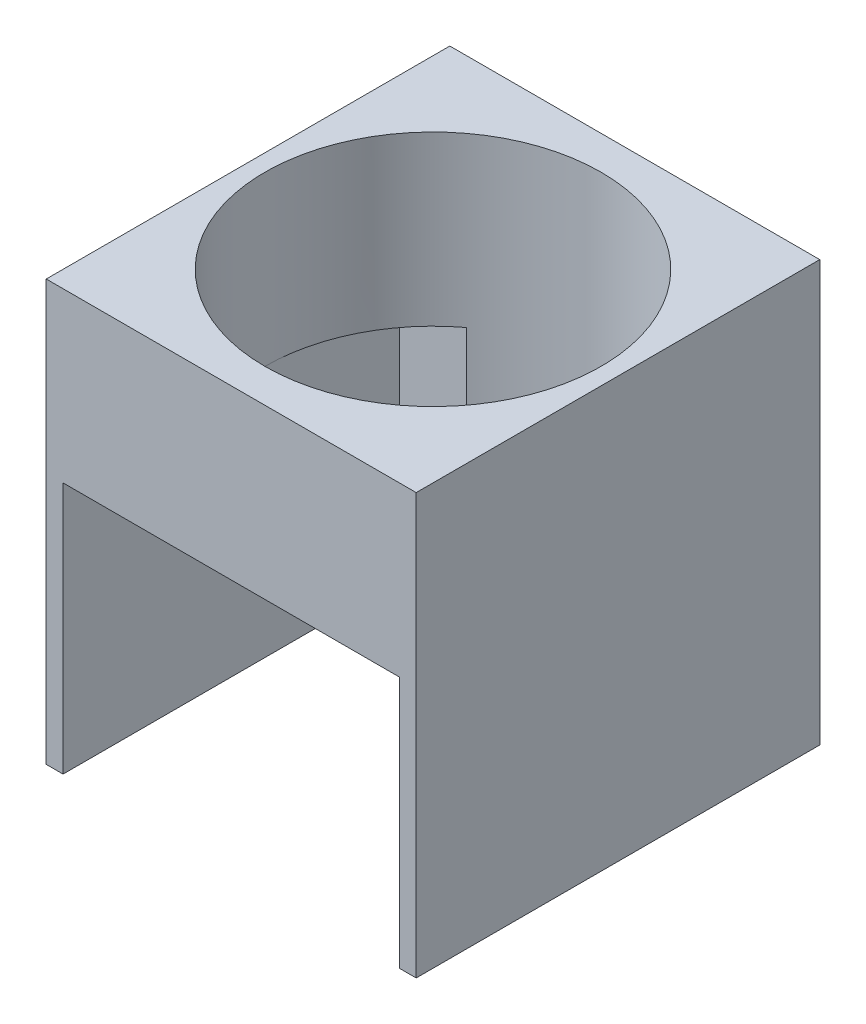
from build123d import *

# Parameters (mm, degrees)
SKETCH1_W                      = 670
SKETCH1_H                      = 120
BOSS_EXTRUDE1_DEPTH            = 530
SKETCH2_W                      = 100
SKETCH2_H                      = 200
SKETCH2_W_2                    = 650
SKETCH2_H_2                    = 250
CUT_EXTRUDE1_DEPTH             = 100
SKETCH3_R                      = 50
CUT_EXTRUDE2_DEPTH             = 260
F_12_0_12_DIAMETER_HOLE2_D     = 12
F_12_0_12_DIAMETER_HOLE2_DEPTH = 30
F_12_0_12_DIAMETER_HOLE2_TIP   = 3.605163714
SKETCH8_W                      = 650
SKETCH8_H                      = 50
BOSS_EXTRUDE2_DEPTH            = 5
SKETCH9_W                      = 10
SKETCH9_H                      = 250
CUT_EXTRUDE3_DEPTH             = 717
CUT_EXTRUDE4_DEPTH             = 5
SKETCH11_W                     = 10
SKETCH11_H                     = 100
BOSS_EXTRUDE3_DEPTH            = 78
BOSS_EXTRUDE3_2_DEPTH          = 78
BOSS_EXTRUDE3_3_DEPTH          = 78
SKETCH12_W                     = 20
SKETCH12_H                     = 30
CUT_EXTRUDE5_DEPTH             = 80
SKETCH15_W                     = 30
SKETCH15_H                     = 23.536156656
SKETCH15_H_2                   = 28.986603691
CUT_EXTRUDE7_DEPTH             = 35
SHELL1_T                       = -3
SKETCH16_W                     = 14
SKETCH16_H                     = 14
CUT_EXTRUDE8_DEPTH             = 35
SKETCH17_W                     = 5.729882812
SKETCH17_H                     = 17.428393554
SKETCH17_W_2                   = 13.369726562
SKETCH17_H_2                   = 3.342431641
BOSS_EXTRUDE4_DEPTH            = 5
SKETCH18_W                     = 670
SKETCH18_H                     = 280
CUT_EXTRUDE10_DEPTH            = 159
CUT_EXTRUDE11_DEPTH            = 863.670273187
CUT_EXTRUDE11_DEPTH_BACK       = 863.670273187
SKETCH19_W                     = 115
SKETCH19_H                     = 250
SKETCH19_W_2                   = 445
CUT_EXTRUDE12_DEPTH            = 777.739982373
CUT_EXTRUDE12_DEPTH_BACK       = 777.739982373
SKETCH20_W                     = 110
SKETCH20_H                     = 125


with BuildPart() as part:
    # Sketch1 → Boss-Extrude1 (new body)
    with BuildSketch(Plane(origin=(0, 0, 0), x_dir=(1, 0, 0), z_dir=(0, 1, 0))):
        with Locations((335, 60)):
            Rectangle(SKETCH1_W, SKETCH1_H)
    extrude(amount=BOSS_EXTRUDE1_DEPTH)

    # Sketch2 → Cut-Extrude1 (cut)
    with BuildSketch(Plane.XY):
        with Locations((60, 380)):
            Rectangle(SKETCH2_W, SKETCH2_H)
        with Locations((170, 380)):
            Rectangle(SKETCH2_W, SKETCH2_H)
        with Locations((280, 380)):
            Rectangle(SKETCH2_W, SKETCH2_H)
        with Locations((390, 380)):
            Rectangle(SKETCH2_W, SKETCH2_H)
        with Locations((500, 380)):
            Rectangle(SKETCH2_W, SKETCH2_H)
        with Locations((610, 380)):
            Rectangle(SKETCH2_W, SKETCH2_H)
        with Locations((335, 135)):
            Rectangle(SKETCH2_W_2, SKETCH2_H_2)
    extrude(amount=-CUT_EXTRUDE1_DEPTH, mode=Mode.SUBTRACT)

    # Sketch3 → Cut-Extrude2 (cut)
    with BuildSketch(Plane(origin=(0, 530, 0), x_dir=(1, 0, 0), z_dir=(0, 1, 0))):
        with Locations(Location((60, 60, 0), (0, 0, 270))):
            Circle(SKETCH3_R)
        with Locations(Location((170, 60, 0), (0, 0, 270))):
            Circle(SKETCH3_R)
        with Locations(Location((280, 60, 0), (0, 0, 270))):
            Circle(SKETCH3_R)
        with Locations(Location((390, 60, 0), (0, 0, 270))):
            Circle(SKETCH3_R)
        with Locations(Location((500, 60, 0), (0, 0, 270))):
            Circle(SKETCH3_R)
        with Locations(Location((610, 60, 0), (0, 0, 270))):
            Circle(SKETCH3_R)
    extrude(amount=-CUT_EXTRUDE2_DEPTH, mode=Mode.SUBTRACT)

    # Ø12.0 (12) Diameter Hole2
    with Locations(Plane(origin=(59.704642413, 270, -102.411697903), x_dir=(0, 0, 1), z_dir=(0, 1, 0))):
        with Locations((0, 0), (-0.195888006, 111.8520513), (0.014838595, 221.167624818), (-0.341843303, 331.364008353), (0.657723149, 441.008646429), (1.288998006, 549.811854685)):
            Hole(F_12_0_12_DIAMETER_HOLE2_D / 2, depth=F_12_0_12_DIAMETER_HOLE2_DEPTH)
            with Locations((0, 0, -(F_12_0_12_DIAMETER_HOLE2_DEPTH + F_12_0_12_DIAMETER_HOLE2_TIP / 2))):  # 118° drill point
                Cone(0, F_12_0_12_DIAMETER_HOLE2_D / 2, F_12_0_12_DIAMETER_HOLE2_TIP, mode=Mode.SUBTRACT)

    # Sketch8 → Boss-Extrude2 (add)
    with BuildSketch(Plane.XY):
        with Locations((335, 305)):
            Rectangle(SKETCH8_W, SKETCH8_H)
    extrude(amount=-BOSS_EXTRUDE2_DEPTH)

    # Sketch9 → Cut-Extrude3 (cut)
    with BuildSketch(Plane(origin=(670, 0, 0), x_dir=(0, 0, -1), z_dir=(1, 0, 0))):
        with Locations((15, 135)):
            Rectangle(SKETCH9_W, SKETCH9_H)
    extrude(amount=-CUT_EXTRUDE3_DEPTH, mode=Mode.SUBTRACT)

    # Sketch10 → Cut-Extrude4 (cut)
    with BuildSketch(Plane(origin=(0, 10, 0), x_dir=(1, 0, 0), z_dir=(0, 1, 0))):
        Polygon((365, 61.943560596), (350, 87.924322709), (320, 87.924322709), (305, 61.943560596), (320, 35.962798482), (350, 35.962798482), align=None)
    extrude(amount=-CUT_EXTRUDE4_DEPTH, mode=Mode.SUBTRACT)

    # Sketch12 → Cut-Extrude5 (cut)
    with BuildSketch(Plane.XY.offset(-100)):
        with Locations((85.198613037, 245)):
            Rectangle(SKETCH12_W, SKETCH12_H)
        with Locations((195.198613037, 245)):
            Rectangle(SKETCH12_W, SKETCH12_H)
        with Locations((305.198613037, 245)):
            Rectangle(SKETCH12_W, SKETCH12_H)
        with Locations((415.198613037, 245)):
            Rectangle(SKETCH12_W, SKETCH12_H)
        with Locations((525.198613037, 245)):
            Rectangle(SKETCH12_W, SKETCH12_H)
        with Locations((635.198613037, 245)):
            Rectangle(SKETCH12_W, SKETCH12_H)
    extrude(amount=-CUT_EXTRUDE5_DEPTH, mode=Mode.SUBTRACT)

    # Sketch17 → Boss-Extrude4 (add)
    # profile 1 of 9: a face of its own
    with BuildSketch(Plane.XY):
        with BuildLine():
            Line((527.508830928, 289.835452458), (527.508830928, 307.263846012))
            Line((527.508830928, 307.263846012), (534.861434459, 307.263846012))
            add(Edge.make_bspline(
                [(534.861434459, 307.263846012), (535.181337774, 307.258256848), (535.803061116, 307.24739446), (536.703508491, 307.139069344), (537.544992916, 306.975202489), (538.325061607, 306.737496792), (539.040841948, 306.426020155), (539.698044515, 306.051894954), (540.290333057, 305.605079277), (540.822348212, 305.090232636), (541.284521701, 304.502523111), (541.692171296, 303.852565801), (542.030284458, 303.129762281), (542.309377095, 302.341316546), (542.5243908, 301.484161689), (542.679660381, 300.560045938), (542.773357357, 299.567500804), (542.783368073, 298.883107022), (542.788518428, 298.530997273)],
                knots=[0, 0, 0, 0, 1.135059408, 2.20595691, 3.214417064, 4.174978569, 5.094187092, 5.980001006, 6.853065862, 7.720814779, 8.600404634, 9.50058483, 10.438414914, 11.426825708, 12.465239141, 13.571113463, 14.750376389, 16, 16, 16, 16], degree=3))
            add(Edge.make_bspline(
                [(542.788518428, 298.530997273), (542.781740751, 298.180151665), (542.768592871, 297.499553336), (542.676885992, 296.511518461), (542.516733301, 295.591080531), (542.296748778, 294.736450427), (542.003051046, 293.953120444), (541.654236167, 293.233205539), (541.233025793, 292.585291498), (540.753136904, 292.000029304), (540.204772188, 291.484681411), (539.587651059, 291.044279297), (538.910779309, 290.668464036), (538.169670382, 290.361903209), (537.364073889, 290.124869172), (536.495133477, 289.954199984), (535.562644449, 289.853487388), (534.920131033, 289.841584621), (534.58911581, 289.835452458)],
                knots=[0, 0, 0, 0, 1.228418252, 2.382983832, 3.470276728, 4.496757894, 5.468023682, 6.394867725, 7.292157164, 8.167372942, 9.039072913, 9.918728341, 10.815246345, 11.744296628, 12.720973084, 13.750736166, 14.841206188, 16, 16, 16, 16], degree=3))
            Line((534.58911581, 289.835452458), (527.508830928, 289.835452458))
        make_face()
        with BuildLine():
            Line((533.238713741, 291.745413395), (534.048208904, 291.745413395))
            add(Edge.make_bspline(
                [(534.048208904, 291.745413395), (534.172894012, 291.749291978), (534.413033311, 291.756761998), (534.758676231, 291.825976613), (535.075745017, 291.938271137), (535.365749176, 292.094802589), (535.623404602, 292.300450923), (535.848862806, 292.551404902), (536.04776914, 292.844737637), (536.217685755, 293.190205032), (536.364284647, 293.596533622), (536.481764702, 294.076367921), (536.592118304, 294.630928744), (536.673672739, 295.265507643), (536.740044562, 295.978448886), (536.788346679, 296.768428292), (536.812018936, 297.636801208), (536.817188964, 298.241258393), (536.819890499, 298.55711002)],
                knots=[0, 0, 0, 0, 0.728710832, 1.403472396, 2.052289494, 2.690292559, 3.321919393, 3.970736491, 4.656696891, 5.388631723, 6.217040872, 7.17856157, 8.275589967, 9.523440737, 10.918935818, 12.463926104, 14.152268318, 16, 16, 16, 16], degree=3))
            add(Edge.make_bspline(
                [(536.819890499, 298.55711002), (536.8171426, 298.871715251), (536.811863063, 299.476166083), (536.7886758, 300.343334385), (536.739579947, 301.133216935), (536.674703848, 301.843934916), (536.589660404, 302.476324031), (536.488366458, 303.031681737), (536.362441588, 303.507627045), (536.222158727, 303.914921549), (536.050140993, 304.256514038), (535.858357073, 304.554097881), (535.62547107, 304.79746827), (535.36991257, 305.004888479), (535.079348843, 305.160875844), (534.761320266, 305.273944358), (534.414185903, 305.34216807), (534.172870641, 305.349893944), (534.048208904, 305.353885075)],
                knots=[0, 0, 0, 0, 1.842836665, 3.540640921, 5.080358154, 6.47765669, 7.719902824, 8.816971715, 9.781579111, 10.601733135, 11.334613876, 12.017393917, 12.666641099, 13.29908421, 13.937911793, 14.587567384, 15.270347425, 16, 16, 16, 16], degree=3))
            Line((534.048208904, 305.353885075), (533.238713741, 305.353885075))
            Line((533.238713741, 305.353885075), (533.238713741, 291.745413395))
        make_face(mode=Mode.SUBTRACT)
    # profile 2 of 9: a face of its own
    with BuildSketch(Plane.XY):
        with Locations((547.563420772, 298.549649235)):
            Rectangle(SKETCH17_W, SKETCH17_H)
    # profile 3 of 9: a face of its own
    with BuildSketch(Plane.XY):
        Polygon((564.514324092, 307.263846012), (564.514324092, 305.115139958), (558.545696163, 305.115139958), (558.545696163, 299.862747379), (563.559343624, 299.862747379), (563.559343624, 297.714041325), (558.545696163, 297.714041325), (558.545696163, 289.835452458), (552.81581335, 289.835452458), (552.81581335, 307.263846012), align=None)
    # profile 4 of 9: a face of its own
    with BuildSketch(Plane.XY):
        Polygon((577.645305538, 307.263846012), (577.645305538, 305.115139958), (571.676677608, 305.115139958), (571.676677608, 299.862747379), (576.690325069, 299.862747379), (576.690325069, 297.714041325), (571.676677608, 297.714041325), (571.676677608, 289.835452458), (565.946794795, 289.835452458), (565.946794795, 307.263846012), align=None)
    # profile 5 of 9: a face of its own
    with BuildSketch(Plane.XY):
        with Locations((584.330168819, 287.448001286)):
            Rectangle(SKETCH17_W_2, SKETCH17_H_2)
    # profile 6 of 9: a face of its own
    with BuildSketch(Plane.XY):
        with BuildLine():
            Line((605.578484249, 307.263846012), (605.578484249, 295.602639195))
            add(Edge.make_bspline(
                [(605.578484249, 295.602639195), (605.574209777, 295.35989389), (605.565919345, 294.889083964), (605.480877158, 294.20653885), (605.349958188, 293.569747554), (605.15926554, 292.978838165), (604.911867049, 292.436847071), (604.616163877, 291.936663973), (604.260702644, 291.487723021), (603.847299908, 291.08966617), (603.386881991, 290.731670113), (602.867295001, 290.425440037), (602.293741958, 290.168488385), (601.66690529, 289.960990771), (600.988052682, 289.797299786), (600.254912883, 289.679078851), (599.467035781, 289.60781007), (598.923618241, 289.60048219), (598.643684673, 289.59670734)],
                knots=[0, 0, 0, 0, 1.108173197, 2.149326602, 3.136215123, 4.073726706, 4.978516626, 5.852185058, 6.72141202, 7.584905625, 8.467554395, 9.379216169, 10.332422268, 11.332766067, 12.390653242, 13.518530507, 14.721707419, 16, 16, 16, 16], degree=3))
            add(Edge.make_bspline(
                [(598.643684673, 289.59670734), (598.373688491, 289.600411437), (597.851346557, 289.607577482), (597.093280473, 289.679448684), (596.387523889, 289.797736542), (595.733050135, 289.960122315), (595.130189942, 290.169220301), (594.579048171, 290.42623041), (594.078350789, 290.732835498), (593.633858028, 291.090104794), (593.234289459, 291.486851767), (592.899913678, 291.940746827), (592.609043638, 292.435866034), (592.375223767, 292.980322997), (592.191754821, 293.570441519), (592.063541006, 294.20666921), (591.983676196, 294.889343196), (591.974661767, 295.359932437), (591.970012569, 295.602639195)],
                knots=[0, 0, 0, 0, 1.258901956, 2.435505865, 3.547148904, 4.59359074, 5.576649289, 6.5183682, 7.424469602, 8.307507093, 9.172751023, 10.042627298, 10.928839176, 11.845659241, 12.799442865, 13.80597989, 14.868432463, 16, 16, 16, 16], degree=3))
            Line((591.970012569, 295.602639195), (591.970012569, 307.263846012))
            Line((591.970012569, 307.263846012), (597.699895381, 307.263846012))
            Line((597.699895381, 307.263846012), (597.699895381, 295.457153889))
            add(Edge.make_bspline(
                [(597.699895381, 295.457153889), (597.700816195, 295.287996189), (597.702584578, 294.963135903), (597.729908723, 294.499051493), (597.768241004, 294.079064133), (597.828226169, 293.705517832), (597.90066041, 293.377063412), (597.989882091, 293.09281535), (598.094998068, 292.852496478), (598.225239063, 292.654232043), (598.380826623, 292.495135011), (598.55368342, 292.353231761), (598.757556996, 292.238543846), (598.987648905, 292.146224908), (599.243380948, 292.070549638), (599.526120553, 292.020376099), (599.83553351, 291.990763905), (600.049971942, 291.986424568), (600.161954402, 291.984158512)],
                knots=[0, 0, 0, 0, 1.622370975, 3.115695595, 4.458049099, 5.666011203, 6.742434742, 7.681714947, 8.519814998, 9.250928664, 9.942747364, 10.646898194, 11.389596108, 12.175933929, 13.021386247, 13.943159715, 14.925891993, 16, 16, 16, 16], degree=3))
            add(Edge.make_bspline(
                [(600.161954402, 291.984158512), (600.283927219, 291.987190593), (600.521124756, 291.993087005), (600.86597014, 292.03390861), (601.187714881, 292.103380086), (601.484890424, 292.205377303), (601.758665297, 292.332852529), (602.012761516, 292.484567923), (602.236391413, 292.674631152), (602.439076761, 292.888441291), (602.620738276, 293.128529789), (602.771757722, 293.399928575), (602.905501548, 293.697121508), (603.005823683, 294.025060118), (603.089837826, 294.379999499), (603.146989706, 294.763086929), (603.186210275, 295.174074524), (603.189394751, 295.457053988), (603.191033077, 295.602639195)],
                knots=[0, 0, 0, 0, 1.083870311, 2.107775948, 3.08105344, 4.003637981, 4.893545291, 5.761570557, 6.624657808, 7.49233129, 8.376387281, 9.291996285, 10.246843261, 11.267344133, 12.334180325, 13.486053461, 14.706643157, 16, 16, 16, 16], degree=3))
            Line((603.191033077, 295.602639195), (603.191033077, 307.263846012))
            Line((603.191033077, 307.263846012), (605.578484249, 307.263846012))
        make_face()
    # profile 7 of 9: a face of its own
    with BuildSketch(Plane.XY):
        with BuildLine():
            Line((619.731593227, 302.015183827), (616.739818477, 301.526502415))
            add(Edge.make_bspline(
                [(616.739818477, 301.526502415), (616.748849224, 301.670726223), (616.765660669, 301.939210177), (616.78429066, 302.312269209), (616.796668381, 302.625642376), (616.798628236, 302.814722915), (616.799504756, 302.899286839)],
                knots=[0, 0, 0, 0, 1.261802504, 2.348944521, 3.261585937, 4, 4, 4, 4], degree=3))
            add(Edge.make_bspline(
                [(616.799504756, 302.899286839), (616.798306068, 303.007660677), (616.795968139, 303.219033721), (616.750451916, 303.523894877), (616.694806916, 303.811547356), (616.604352699, 304.076787391), (616.488181329, 304.320314265), (616.348943917, 304.543955606), (616.184187178, 304.745078709), (615.995833421, 304.928129987), (615.778009957, 305.083200131), (615.536269472, 305.218702836), (615.269765326, 305.333844758), (614.978065514, 305.431346685), (614.660683072, 305.504624438), (614.319025281, 305.556776695), (613.952471696, 305.585673441), (613.699597795, 305.590260771), (613.568984889, 305.592630192)],
                knots=[0, 0, 0, 0, 1.079280541, 2.105035848, 3.067950317, 3.99715044, 4.889989748, 5.753421302, 6.617030865, 7.476358039, 8.364190572, 9.274590025, 10.235106994, 11.254473582, 12.337095886, 13.478601727, 14.697662529, 16, 16, 16, 16], degree=3))
            add(Edge.make_bspline(
                [(613.568984889, 305.592630192), (613.391954632, 305.58912286), (613.059112606, 305.582528579), (612.595688488, 305.495339748), (612.198743126, 305.361419257), (611.87165349, 305.163811893), (611.613188167, 304.909795747), (611.433841092, 304.593316589), (611.323009072, 304.224665915), (611.313400221, 303.959558324), (611.308367061, 303.820693775)],
                knots=[0, 0, 0, 0, 1.294917039, 2.43462794, 3.440028966, 4.347597256, 5.210608309, 6.06356377, 6.985685997, 8, 8, 8, 8], degree=3))
            add(Edge.make_bspline(
                [(611.308367061, 303.820693775), (611.317562032, 303.705133219), (611.336106628, 303.472068433), (611.47315858, 303.132808312), (611.695999602, 302.811560885), (612.009295906, 302.510664216), (612.404107796, 302.221967273), (612.884407504, 301.948533431), (613.450813789, 301.688189695), (613.862519081, 301.536023727), (614.080048656, 301.455624958)],
                knots=[0, 0, 0, 0, 0.716839541, 1.445735977, 2.240793036, 3.131329288, 4.131129903, 5.273471266, 6.559404876, 8, 8, 8, 8], degree=3))
            add(Edge.make_bspline(
                [(614.080048656, 301.455624958), (614.335934702, 301.364918412), (614.834564244, 301.188164095), (615.547657928, 300.88707802), (616.213068388, 300.5749594), (616.829579094, 300.246613346), (617.397833174, 299.90520698), (617.914851624, 299.544556457), (618.386199073, 299.173962102), (618.807001026, 298.783874588), (619.177995113, 298.378100064), (619.4958685, 297.952745357), (619.771807525, 297.51723103), (619.991113975, 297.061458502), (620.169645242, 296.594624218), (620.292698657, 296.11024444), (620.364288243, 295.609761088), (620.37516617, 295.270864226), (620.380681514, 295.099036213)],
                knots=[0, 0, 0, 0, 1.359488612, 2.649152603, 3.874964776, 5.039588756, 6.146130126, 7.193090393, 8.194917302, 9.146793662, 10.063845301, 10.944476293, 11.803344532, 12.641736646, 13.473440096, 14.302714936, 15.139439897, 16, 16, 16, 16], degree=3))
            add(Edge.make_bspline(
                [(620.380681514, 295.099036213), (620.374476075, 294.902306495), (620.362285176, 294.515820995), (620.280160209, 293.948630617), (620.138011896, 293.409496554), (619.938489338, 292.895972278), (619.681049879, 292.411946655), (619.366518754, 291.954381076), (618.996510229, 291.525099427), (618.5710008, 291.128381035), (618.102222518, 290.765302239), (617.587803957, 290.450854345), (617.034458515, 290.187092261), (616.444107988, 289.968993032), (615.81453624, 289.801373099), (615.145337453, 289.685291013), (614.438790193, 289.606619894), (613.954683001, 289.600062276), (613.70700941, 289.59670734)],
                knots=[0, 0, 0, 0, 0.972121714, 1.909782367, 2.824924061, 3.721832975, 4.62620438, 5.527836938, 6.46026819, 7.421000932, 8.398101015, 9.385579713, 10.394244048, 11.422703992, 12.491421888, 13.608778581, 14.776629625, 16, 16, 16, 16], degree=3))
            add(Edge.make_bspline(
                [(613.70700941, 289.59670734), (613.445745367, 289.599650312), (612.939893069, 289.605348413), (612.207608113, 289.66709241), (611.525297432, 289.760984454), (610.893395078, 289.899706116), (610.309273131, 290.072394336), (609.776099392, 290.288320955), (609.295310255, 290.547303481), (608.863217672, 290.843007892), (608.478306623, 291.175775461), (608.148120946, 291.551766865), (607.86942369, 291.967163224), (607.639947144, 292.421521488), (607.466477665, 292.917583541), (607.339164663, 293.449829748), (607.264537999, 294.021332449), (607.254747521, 294.414908557), (607.249700069, 294.617815586)],
                knots=[0, 0, 0, 0, 1.342201143, 2.598733168, 3.773451092, 4.878874364, 5.91991243, 6.900006476, 7.829142054, 8.72062616, 9.585588575, 10.436728592, 11.283829734, 12.149664931, 13.044964919, 13.977937424, 14.957531465, 16, 16, 16, 16], degree=3))
            add(Edge.make_bspline(
                [(607.249700069, 294.617815586), (607.250803815, 294.692425759), (607.253213998, 294.855347393), (607.260452266, 295.122772538), (607.275636683, 295.433682216), (607.29037174, 295.656130545), (607.298195171, 295.774237248)],
                knots=[0, 0, 0, 0, 0.773500207, 1.689044709, 2.77302154, 4, 4, 4, 4], degree=3))
            Line((607.298195171, 295.774237248), (610.36457777, 296.337526509))
            add(Edge.make_bspline(
                [(610.36457777, 296.337526509), (610.326952988, 296.136337493), (610.255606535, 295.754830366), (610.178678473, 295.21219969), (610.124206629, 294.733311493), (610.11767002, 294.435147371), (610.114641475, 294.297001835)],
                knots=[0, 0, 0, 0, 1.192988372, 2.262218769, 3.194850416, 4, 4, 4, 4], degree=3))
            add(Edge.make_bspline(
                [(610.114641475, 294.297001835), (610.116191817, 294.183708768), (610.119182568, 293.965156219), (610.159053378, 293.648552813), (610.215988606, 293.352999663), (610.302906772, 293.079707227), (610.411206928, 292.826307836), (610.544682453, 292.59538211), (610.704385489, 292.386485019), (610.887496571, 292.200099922), (611.094689168, 292.033628705), (611.327456494, 291.892756696), (611.58347653, 291.771733922), (611.864681562, 291.677479524), (612.167961721, 291.596080628), (612.497219749, 291.548235723), (612.849461228, 291.512043782), (613.092629543, 291.508500084), (613.218327999, 291.506668278)],
                knots=[0, 0, 0, 0, 1.135776692, 2.191015738, 3.19649269, 4.151244236, 5.061952528, 5.956281389, 6.819534407, 7.692823504, 8.571441916, 9.478554956, 10.416037156, 11.406231466, 12.450054172, 13.561596327, 14.739541482, 16, 16, 16, 16], degree=3))
            add(Edge.make_bspline(
                [(613.218327999, 291.506668278), (613.423996012, 291.510791273), (613.810619321, 291.518541853), (614.349272542, 291.616708407), (614.810575885, 291.768742445), (615.189785268, 291.991387532), (615.490778961, 292.278756613), (615.698005174, 292.637320004), (615.824813318, 293.05638326), (615.837728413, 293.355975238), (615.844524288, 293.513619419)],
                knots=[0, 0, 0, 0, 1.308765556, 2.460272085, 3.475015317, 4.388076298, 5.239673503, 6.095681635, 6.997954785, 8, 8, 8, 8], degree=3))
            add(Edge.make_bspline(
                [(615.844524288, 293.513619419), (615.833808824, 293.638242951), (615.811807312, 293.894126055), (615.644884004, 294.264515838), (615.382382362, 294.620631473), (615.016807277, 294.962984909), (614.551376589, 295.293471235), (613.986957743, 295.616730224), (613.322148235, 295.933112033), (612.83677959, 296.119639164), (612.580430889, 296.21815395)],
                knots=[0, 0, 0, 0, 0.667930748, 1.371427933, 2.146459016, 3.034714139, 4.04893387, 5.207327294, 6.525042705, 8, 8, 8, 8], degree=3))
            add(Edge.make_bspline(
                [(612.580430889, 296.21815395), (612.374354345, 296.29679374), (611.970646869, 296.450850434), (611.394079385, 296.713586304), (610.853066711, 296.987016804), (610.357486361, 297.288235735), (609.896382561, 297.599610528), (609.477036946, 297.932256792), (609.09841673, 298.284556341), (608.758710772, 298.653375077), (608.457302107, 299.038989264), (608.199448649, 299.444659231), (607.977533299, 299.866789834), (607.798609588, 300.308107488), (607.65975715, 300.767821241), (607.559616231, 301.244439392), (607.497905054, 301.739995674), (607.491630423, 302.075933546), (607.488445186, 302.246468159)],
                knots=[0, 0, 0, 0, 1.249558333, 2.447906163, 3.58867143, 4.682264114, 5.731748367, 6.739728761, 7.711906036, 8.659384707, 9.578321416, 10.481344598, 11.379544271, 12.277135726, 13.175418307, 14.097160112, 15.034047388, 16, 16, 16, 16], degree=3))
            add(Edge.make_bspline(
                [(607.488445186, 302.246468159), (607.49282555, 302.439538736), (607.501402184, 302.817565692), (607.587451154, 303.36980586), (607.719291893, 303.894921371), (607.910558542, 304.389343064), (608.156192894, 304.852853762), (608.453187669, 305.288766511), (608.804241719, 305.697593471), (609.213503754, 306.066686531), (609.657214714, 306.407618241), (610.14376173, 306.697651931), (610.658716537, 306.950861947), (611.210636666, 307.148827868), (611.791820619, 307.313252612), (612.408080529, 307.421140415), (613.056315391, 307.490701612), (613.499160755, 307.498567824), (613.725661373, 307.502591129)],
                knots=[0, 0, 0, 0, 1.01033566, 1.978209831, 2.919499157, 3.840961976, 4.746855014, 5.660740114, 6.597989116, 7.56120833, 8.541877795, 9.523498025, 10.522416858, 11.542172371, 12.589598349, 13.681636521, 14.814234488, 16, 16, 16, 16], degree=3))
            add(Edge.make_bspline(
                [(613.725661373, 307.502591129), (613.968269855, 307.498219033), (614.438190994, 307.489750488), (615.120391152, 307.426787419), (615.755073228, 307.319142339), (616.345153155, 307.171557286), (616.887304575, 306.977590666), (617.384933999, 306.742393454), (617.834452216, 306.46201507), (618.236961315, 306.139451502), (618.593086714, 305.773322851), (618.897467704, 305.361641069), (619.158701245, 304.909408454), (619.366684143, 304.412232174), (619.529870326, 303.873247147), (619.649133834, 303.29158184), (619.720420497, 302.667301443), (619.72779778, 302.236712324), (619.731593227, 302.015183827)],
                knots=[0, 0, 0, 0, 1.248314423, 2.417925914, 3.521398822, 4.558068205, 5.543720209, 6.479599284, 7.385061127, 8.263440163, 9.127722873, 10.00561236, 10.891325273, 11.808802823, 12.772251995, 13.784947978, 14.860405143, 16, 16, 16, 16], degree=3))
        make_face()
    # profile 8 of 9: a face of its own
    with BuildSketch(Plane.XY):
        Polygon((633.989153194, 307.263846012), (633.989153194, 305.115139958), (628.020525264, 305.115139958), (628.020525264, 300.340237614), (633.034172725, 300.340237614), (633.034172725, 298.191531559), (628.020525264, 298.191531559), (628.020525264, 291.984158512), (634.944133663, 291.984158512), (634.944133663, 289.835452458), (622.290642452, 289.835452458), (622.290642452, 307.263846012), align=None)
    # profile 9 of 9: a face of its own
    with BuildSketch(Plane.XY):
        with BuildLine():
            Line((636.376604366, 289.835452458), (636.376604366, 307.263846012))
            Line((636.376604366, 307.263846012), (643.990335369, 307.263846012))
            add(Edge.make_bspline(
                [(643.990335369, 307.263846012), (644.237946498, 307.261150834), (644.721600887, 307.25588639), (645.426490561, 307.189203683), (646.094808274, 307.090496236), (646.724915796, 306.949857504), (647.317873659, 306.767252686), (647.871119087, 306.542146), (648.390701058, 306.282329135), (648.864494846, 305.976472528), (649.295093616, 305.642889252), (649.669668547, 305.279483604), (649.990389523, 304.894749072), (650.250664962, 304.483256345), (650.454275633, 304.048690948), (650.59581384, 303.587791605), (650.684089268, 303.104102537), (650.695510601, 302.772834174), (650.701311397, 302.604585835)],
                knots=[0, 0, 0, 0, 1.303269877, 2.545653735, 3.724355284, 4.8584284, 5.941462088, 6.987020715, 8.000098032, 8.995332524, 9.951400474, 10.863507538, 11.737823931, 12.582415999, 13.420128714, 14.25671499, 15.114600608, 16, 16, 16, 16], degree=3))
            add(Edge.make_bspline(
                [(650.701311397, 302.604585835), (650.698282873, 302.472674957), (650.692382063, 302.215658276), (650.651041486, 301.838684287), (650.580643818, 301.480313933), (650.481036683, 301.139915259), (650.347814833, 300.820175594), (650.191279492, 300.517863507), (650.009772227, 300.230553342), (649.788675198, 299.970497982), (649.548268341, 299.722842359), (649.274558803, 299.497116911), (648.974487035, 299.288655528), (648.642526299, 299.104010513), (648.287619671, 298.928055749), (647.899038177, 298.784921972), (647.486819978, 298.644749395), (647.19793098, 298.577036306), (647.049257183, 298.54218845)],
                knots=[0, 0, 0, 0, 1.057156483, 2.059775939, 3.035078039, 3.981068617, 4.897189472, 5.80650904, 6.70770952, 7.613691521, 8.536886357, 9.470937334, 10.45233069, 11.461024139, 12.51295332, 13.623444893, 14.776929983, 16, 16, 16, 16], degree=3))
            add(Edge.make_bspline(
                [(647.049257183, 298.54218845), (647.19164695, 298.499279419), (647.467865022, 298.416041346), (647.856360945, 298.265600017), (648.211652989, 298.111536308), (648.524185739, 297.936781388), (648.807636894, 297.762122504), (649.047122259, 297.564301324), (649.255235567, 297.361673563), (649.425188343, 297.135464734), (649.570253643, 296.882344437), (649.694827156, 296.586596707), (649.815179167, 296.247423665), (649.917667348, 295.859098311), (650.004750555, 295.423699276), (650.088222437, 294.944027189), (650.153853601, 294.416024546), (650.187587341, 294.048412906), (650.2051692, 293.856815525)],
                knots=[0, 0, 0, 0, 1.149282524, 2.229462177, 3.219229774, 4.139917433, 4.995948464, 5.788695735, 6.536448429, 7.236319808, 7.968460079, 8.78645307, 9.713791991, 10.749194692, 11.887975363, 13.146018663, 14.512518948, 16, 16, 16, 16], degree=3))
            add(Edge.make_bspline(
                [(650.2051692, 293.856815525), (650.225980287, 293.627849833), (650.265975604, 293.187817268), (650.348933081, 292.554613589), (650.44386163, 291.974357025), (650.555874504, 291.44528724), (650.681301216, 290.967898855), (650.821280597, 290.540469593), (650.979920039, 290.165788217), (651.10484481, 289.941461656), (651.163880062, 289.835452458)],
                knots=[0, 0, 0, 0, 1.324580516, 2.545615266, 3.678710841, 4.711533017, 5.660403917, 6.521349952, 7.301239649, 8, 8, 8, 8], degree=3))
            Line((651.163880062, 289.835452458), (645.213904094, 289.835452458))
            add(Edge.make_bspline(
                [(645.213904094, 289.835452458), (645.12229736, 290.069847279), (644.935171241, 290.548648246), (644.7595281, 291.319414791), (644.64846922, 292.142514735), (644.635117598, 292.70994511), (644.628232479, 293.002555653)],
                knots=[0, 0, 0, 0, 0.930410518, 1.900560147, 2.917368081, 4, 4, 4, 4], degree=3))
            Line((644.628232479, 293.002555653), (644.605850124, 294.002300831))
            Line((644.605850124, 294.002300831), (644.579737377, 295.266903874))
            add(Edge.make_bspline(
                [(644.579737377, 295.266903874), (644.573694669, 295.477395004), (644.562357007, 295.872330118), (644.469348432, 296.426164013), (644.30178735, 296.894645884), (644.073222546, 297.287223005), (643.766741442, 297.590613479), (643.39104803, 297.804152917), (642.950456912, 297.93396284), (642.634664848, 297.946292392), (642.468335247, 297.952786442)],
                knots=[0, 0, 0, 0, 1.295300309, 2.430314163, 3.439929415, 4.342995669, 5.203512789, 6.060756153, 6.978588463, 8, 8, 8, 8], degree=3))
            Line((642.468335247, 297.952786442), (642.106487178, 297.952786442))
            Line((642.106487178, 297.952786442), (642.106487178, 289.835452458))
            Line((642.106487178, 289.835452458), (636.376604366, 289.835452458))
        make_face()
        with BuildLine():
            Line((642.106487178, 299.862747379), (642.617550945, 299.862747379))
            add(Edge.make_bspline(
                [(642.617550945, 299.862747379), (642.722054451, 299.865172716), (642.925280724, 299.869889229), (643.220054897, 299.898289891), (643.494111408, 299.951809873), (643.749840966, 300.021017819), (643.984372137, 300.114851792), (644.200147241, 300.225818296), (644.391160406, 300.362685327), (644.565327067, 300.516342321), (644.718148635, 300.691986294), (644.850351299, 300.889034217), (644.961199162, 301.106225057), (645.056078491, 301.342818683), (645.125883912, 301.600830857), (645.173262731, 301.879472914), (645.203404658, 302.177423605), (645.207875435, 302.383174491), (645.210173702, 302.488943669)],
                knots=[0, 0, 0, 0, 1.184986479, 2.304423995, 3.352332712, 4.347714965, 5.303263624, 6.211353909, 7.091434645, 7.960150225, 8.839440182, 9.723126897, 10.64371617, 11.599264829, 12.608232147, 13.667459739, 14.800924404, 16, 16, 16, 16], degree=3))
            add(Edge.make_bspline(
                [(645.210173702, 302.488943669), (645.207875435, 302.594712847), (645.203404658, 302.800463732), (645.173262731, 303.098414423), (645.125883912, 303.37705648), (645.056078491, 303.635068654), (644.961199162, 303.87166228), (644.850351299, 304.08885312), (644.718148635, 304.285901043), (644.565327067, 304.461545017), (644.391160406, 304.61520201), (644.200147241, 304.752069041), (643.984372137, 304.863035546), (643.749840966, 304.956869518), (643.494111408, 305.026077464), (643.220054897, 305.079597446), (642.925280724, 305.107998108), (642.722054451, 305.112714621), (642.617550945, 305.115139958)],
                knots=[0, 0, 0, 0, 1.199075596, 2.332540261, 3.391767853, 4.400735171, 5.35628383, 6.276873103, 7.160559818, 8.039849775, 8.908565355, 9.788646091, 10.696736376, 11.652285035, 12.647667288, 13.695576005, 14.815013521, 16, 16, 16, 16], degree=3))
            Line((642.617550945, 305.115139958), (642.106487178, 305.115139958))
            Line((642.106487178, 305.115139958), (642.106487178, 299.862747379))
        make_face(mode=Mode.SUBTRACT)
    extrude(amount=BOSS_EXTRUDE4_DEPTH)


with BuildPart() as body_2:
    # Sketch11 → Boss-Extrude3 (new body)
    with BuildSketch(Plane.XY.offset(-100)):
        with Locations((255, 60)):
            Rectangle(SKETCH11_W, SKETCH11_H)
    extrude(amount=BOSS_EXTRUDE3_DEPTH)


with BuildPart() as body_3:
    # Sketch11 → Boss-Extrude3 2 (new body)
    with BuildSketch(Plane.XY.offset(-100)):
        with Locations((415, 60)):
            Rectangle(SKETCH11_W, SKETCH11_H)
    extrude(amount=BOSS_EXTRUDE3_2_DEPTH)


with BuildPart() as body_4:
    # Sketch11 → Boss-Extrude3 3 (new body)
    with BuildSketch(Plane.XY.offset(-100)):
        Polygon((25, 198.45686471), (325, 145.558770497), (325, 122.01775856), (345, 122.01775856), (345, 145.558770497), (645, 198.45686471), align=None)
    extrude(amount=BOSS_EXTRUDE3_3_DEPTH)

    # Sketch15 → Cut-Extrude7 (cut)
    with BuildSketch(Plane(origin=(345, 0, 0), x_dir=(0, 0, -1), z_dir=(1, 0, 0))):
        with Locations((35, 133.231921672)):
            Rectangle(SKETCH15_W, SKETCH15_H)
        with Locations((85, 130.506698154)):
            Rectangle(SKETCH15_W, SKETCH15_H_2)
    extrude(amount=-CUT_EXTRUDE7_DEPTH, mode=Mode.SUBTRACT)

    # Shell1
    shell1_openings = [body_4.faces().sort_by_distance(p)[0] for p in [
        (335, 198.45686471, -61),
    ]]
    offset(amount=SHELL1_T, openings=shell1_openings, kind=Kind.INTERSECTION)

    # Sketch16 → Cut-Extrude8 (cut)
    with BuildSketch(Plane.XZ.offset(-122.01775856)):
        with Locations((335, -60)):
            Rectangle(SKETCH16_W, SKETCH16_H)
    extrude(amount=-CUT_EXTRUDE8_DEPTH, mode=Mode.SUBTRACT)


with BuildPart() as cut_extrude10_tool:
    # Sketch18 → Cut-Extrude10 (new body)
    with BuildSketch(Plane.XY):
        with Locations((335, 140)):
            Rectangle(SKETCH18_W, SKETCH18_H)
    extrude(amount=-CUT_EXTRUDE10_DEPTH)


with BuildPart() as part_1:
    add(part.part)

    # Cut-Extrude10: cut by cut_extrude10_tool
    add(cut_extrude10_tool.part, mode=Mode.SUBTRACT)

    # Sketch19 → Cut-Extrude11 (cut, two sides: drawn at the far end of the back side and taken through both)
    with BuildSketch(Plane.XY.offset(-CUT_EXTRUDE11_DEPTH_BACK)):
        with Locations((612.5, 405)):
            Rectangle(SKETCH19_W, SKETCH19_H)
        with Locations((222.5, 405)):
            Rectangle(SKETCH19_W_2, SKETCH19_H)
    extrude(amount=CUT_EXTRUDE11_DEPTH + CUT_EXTRUDE11_DEPTH_BACK, mode=Mode.SUBTRACT)

    # Sketch20 → Cut-Extrude12 (cut, two sides: drawn at the far end of the back side and taken through both)
    with BuildSketch(Plane.XY.offset(-CUT_EXTRUDE12_DEPTH_BACK)):
        with Locations((500, 342.5)):
            Rectangle(SKETCH20_W, SKETCH20_H)
    extrude(amount=CUT_EXTRUDE12_DEPTH + CUT_EXTRUDE12_DEPTH_BACK, mode=Mode.SUBTRACT)


with BuildPart() as body_2_1:
    add(body_2.part)

    # Cut-Extrude10: cut by cut_extrude10_tool
    add(cut_extrude10_tool.part, mode=Mode.SUBTRACT)


with BuildPart() as body_3_1:
    add(body_3.part)

    # Cut-Extrude10: cut by cut_extrude10_tool
    add(cut_extrude10_tool.part, mode=Mode.SUBTRACT)


with BuildPart() as body_4_1:
    add(body_4.part)

    # Cut-Extrude10: cut by cut_extrude10_tool
    add(cut_extrude10_tool.part, mode=Mode.SUBTRACT)


solid = part_1.part
